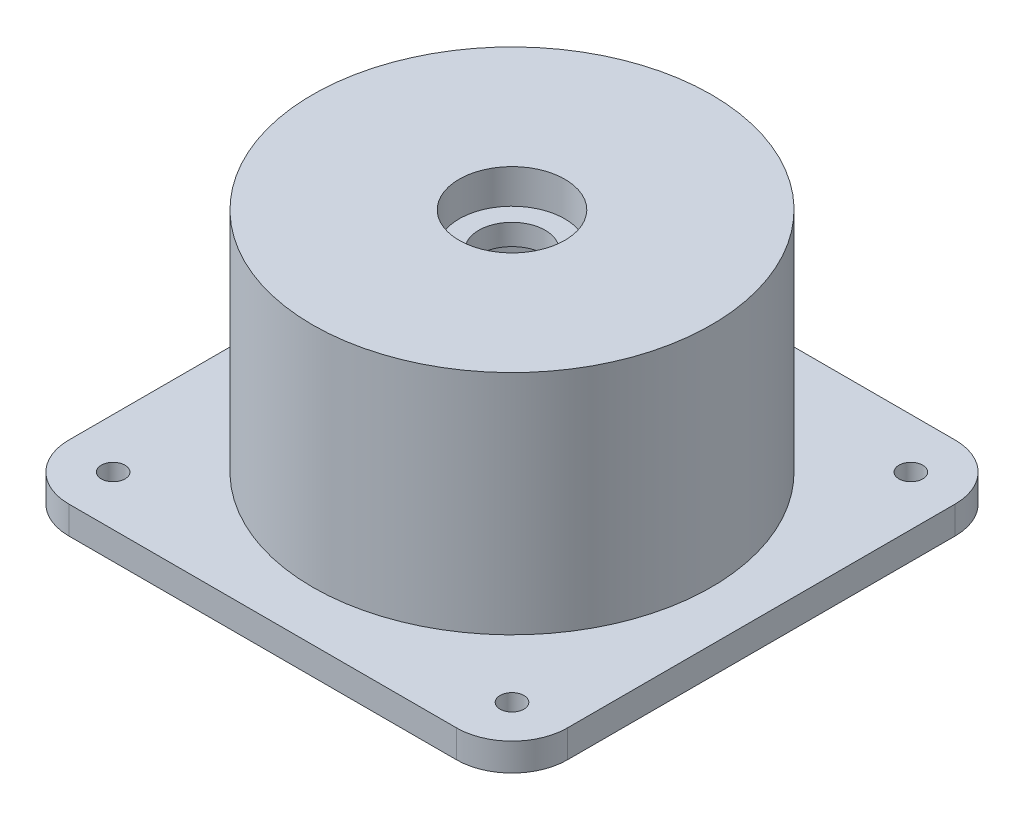
from build123d import *

# Parameters (mm, degrees)
SKETCH3_R           = 2.15
BOSS_EXTRUDE1_DEPTH = 5
SKETCH4_R           = 36
BOSS_EXTRUDE2_DEPTH = 41
SKETCH5_R           = 9.55
CUT_EXTRUDE1_DEPTH  = 6.2
SKETCH6_R           = 32
CUT_EXTRUDE2_DEPTH  = 36
SKETCH8_R           = 6
CUT_EXTRUDE3_DEPTH  = 76.060242472


with BuildPart() as part:
    # Sketch3 → Boss-Extrude1 (new body)
    with BuildSketch(Plane(origin=(0, 0, 0), x_dir=(1, 0, 0), z_dir=(0, 1, 0))):
        with BuildLine():
            Line((-35, 45), (35, 45))
            ThreePointArc((35, 45), (42.071067812, 42.071067812), (45, 35))
            Line((45, 35), (45, -35))
            ThreePointArc((45, -35), (42.071067812, -42.071067812), (35, -45))
            Line((35, -45), (-35, -45))
            ThreePointArc((-35, -45), (-42.071067812, -42.071067812), (-45, -35))
            Line((-45, -35), (-45, 35))
            ThreePointArc((-45, 35), (-42.071067812, 42.071067812), (-35, 45))
        make_face()
        with Locations(Location((-36, 36, 0), (0, 0, 270))):
            Circle(SKETCH3_R, mode=Mode.SUBTRACT)
        with Locations(Location((36, 36, 0), (0, 0, 270))):
            Circle(SKETCH3_R, mode=Mode.SUBTRACT)
        with Locations(Location((36, -36, 0), (0, 0, 270))):
            Circle(SKETCH3_R, mode=Mode.SUBTRACT)
        with Locations(Location((-36, -36, 0), (0, 0, 270))):
            Circle(SKETCH3_R, mode=Mode.SUBTRACT)
    extrude(amount=BOSS_EXTRUDE1_DEPTH)

    # Sketch4 → Boss-Extrude2 (add)
    with BuildSketch(Plane(origin=(0, 5, 0), x_dir=(1, 0, 0), z_dir=(0, 1, 0))):
        with Locations(Location((0, 0, 0), (0, 0, 270))):
            Circle(SKETCH4_R)
    extrude(amount=BOSS_EXTRUDE2_DEPTH)

    # Sketch5 → Cut-Extrude1 (cut)
    with BuildSketch(Plane(origin=(0, 46, 0), x_dir=(1, 0, 0), z_dir=(0, 1, 0))):
        with Locations(Location((0, 0, 0), (0, 0, 270))):
            Circle(SKETCH5_R)
    extrude(amount=-CUT_EXTRUDE1_DEPTH, mode=Mode.SUBTRACT)

    # Sketch6 → Cut-Extrude2 (cut)
    with BuildSketch(Plane.XZ):
        with Locations(Location((0, 0, 0), (0, 0, 270))):
            Circle(SKETCH6_R)
    extrude(amount=-CUT_EXTRUDE2_DEPTH, mode=Mode.SUBTRACT)

    # Sketch8 → Cut-Extrude3 (cut, through all)
    with BuildSketch(Plane(origin=(0, 39.8, 0), x_dir=(1, 0, 0), z_dir=(0, 1, 0))):
        with Locations(Location((0, 0, 0), (0, 0, 270))):
            Circle(SKETCH8_R)
    extrude(amount=-CUT_EXTRUDE3_DEPTH, mode=Mode.SUBTRACT)


solid = part.part
